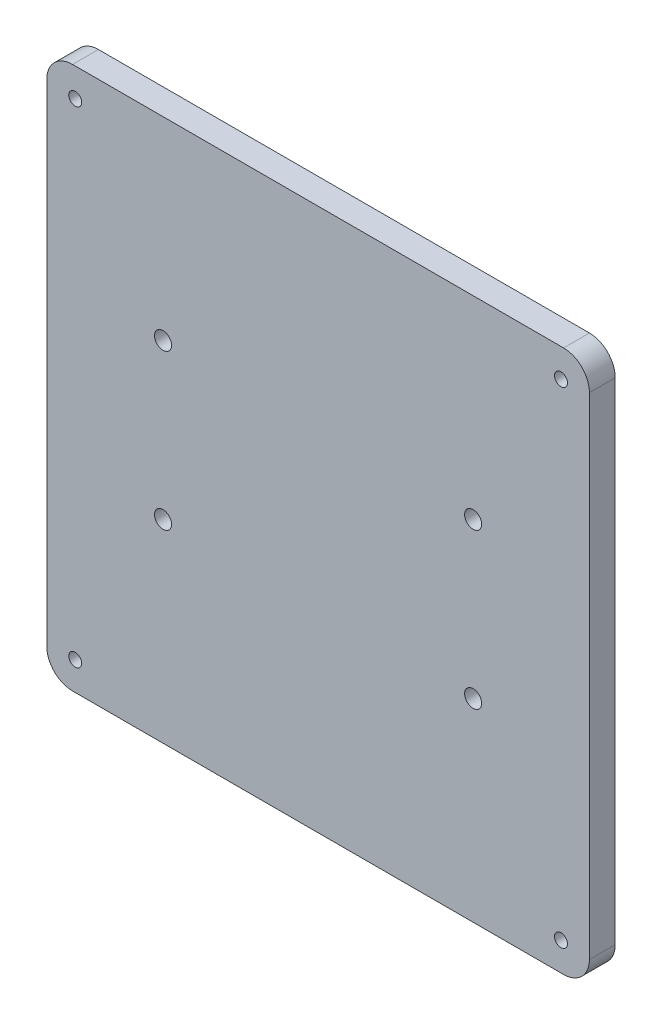
from build123d import *

# Parameters (mm, degrees)
ESQUISSE1_W        = 105
ESQUISSE1_H        = 105
ESQUISSE1_R        = 1.25
ESQUISSE1_R_2      = 1.65
BOSS_EXTRU_1_DEPTH = 5
CONG_1_R           = 5


with BuildPart() as part:
    # Esquisse1 → Boss.-Extru.1 (new body)
    with BuildSketch(Plane.XY):
        with Locations((52.5, 52.5)):
            Rectangle(ESQUISSE1_W, ESQUISSE1_H)
        with Locations((5.5, 5.5)):
            Circle(ESQUISSE1_R, mode=Mode.SUBTRACT)
        with Locations(Location((99.5, 5.5, 0), (0, 0, 180))):
            Circle(ESQUISSE1_R, mode=Mode.SUBTRACT)
        with Locations((99.5, 99.5)):
            Circle(ESQUISSE1_R, mode=Mode.SUBTRACT)
        with Locations(Location((5.5, 99.5, 0), (0, 0, 180))):
            Circle(ESQUISSE1_R, mode=Mode.SUBTRACT)
        with Locations((22.5, 67.5)):
            Circle(ESQUISSE1_R_2, mode=Mode.SUBTRACT)
        with Locations(Location((22.5, 37.5, 0), (0, 0, 180))):
            Circle(ESQUISSE1_R_2, mode=Mode.SUBTRACT)
        with Locations((82.5, 37.5)):
            Circle(ESQUISSE1_R_2, mode=Mode.SUBTRACT)
        with Locations(Location((82.5, 67.5, 0), (0, 0, 180))):
            Circle(ESQUISSE1_R_2, mode=Mode.SUBTRACT)
    extrude(amount=BOSS_EXTRU_1_DEPTH)

    # Congé1
    cong_1_edges = [part.edges().sort_by_distance(p)[0] for p in [
        (0, 105, 2.5),
        (105, 105, 2.5),
        (105, 0, 2.5),
        (0, 0, 2.5),
    ]]
    fillet(cong_1_edges, radius=CONG_1_R)


solid = part.part
